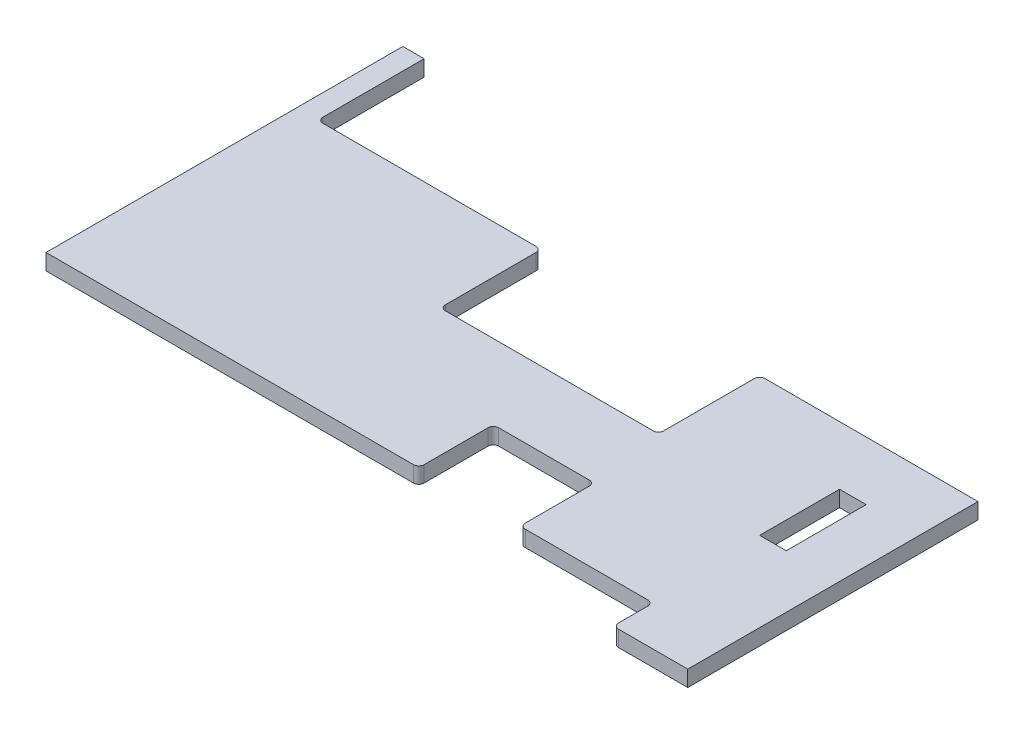
from build123d import *

# Parameters (mm, degrees)
BOSS_EXTRUDE1_DEPTH = 3
SKETCH2_W           = 5
SKETCH2_H           = 15
CUT_EXTRUDE1_DEPTH  = 145.506055236
FILLET1_R           = 1


with BuildPart() as part:
    # Sketch1 → Boss-Extrude1 (new body)
    with BuildSketch(Plane(origin=(0, 0, 0), x_dir=(1, 0, 0), z_dir=(0, 1, 0))):
        Polygon((0, 67), (4, 67), (4, 47), (46, 47), (46, 28), (87, 28), (87, 47), (128, 47), (128, -7.5), (114, -7.5), (114, 0), (89, 0), (89, 14), (70, 14), (70, 0), (0, 0), align=None)
    extrude(amount=BOSS_EXTRUDE1_DEPTH)

    # Sketch2 → Cut-Extrude1 (cut, through all)
    with BuildSketch(Plane(origin=(0, 3, 0), x_dir=(1, 0, 0), z_dir=(0, 1, 0))):
        with Locations((115.5, 28.5)):
            Rectangle(SKETCH2_W, SKETCH2_H)
    extrude(amount=-CUT_EXTRUDE1_DEPTH, mode=Mode.SUBTRACT)

    # Fillet1
    fillet1_edges = [part.edges().sort_by_distance(p)[0] for p in [
        (4, 1.5, -47),
        (46, 1.5, -47),
        (46, 1.5, -28),
        (87, 1.5, -28),
        (87, 1.5, -47),
        (114, 1.5, 7.5),
        (114, 1.5, 0),
        (89, 1.5, 0),
        (89, 1.5, -14),
        (70, 1.5, -14),
        (70, 1.5, 0),
    ]]
    fillet(fillet1_edges, radius=FILLET1_R)


solid = part.part
